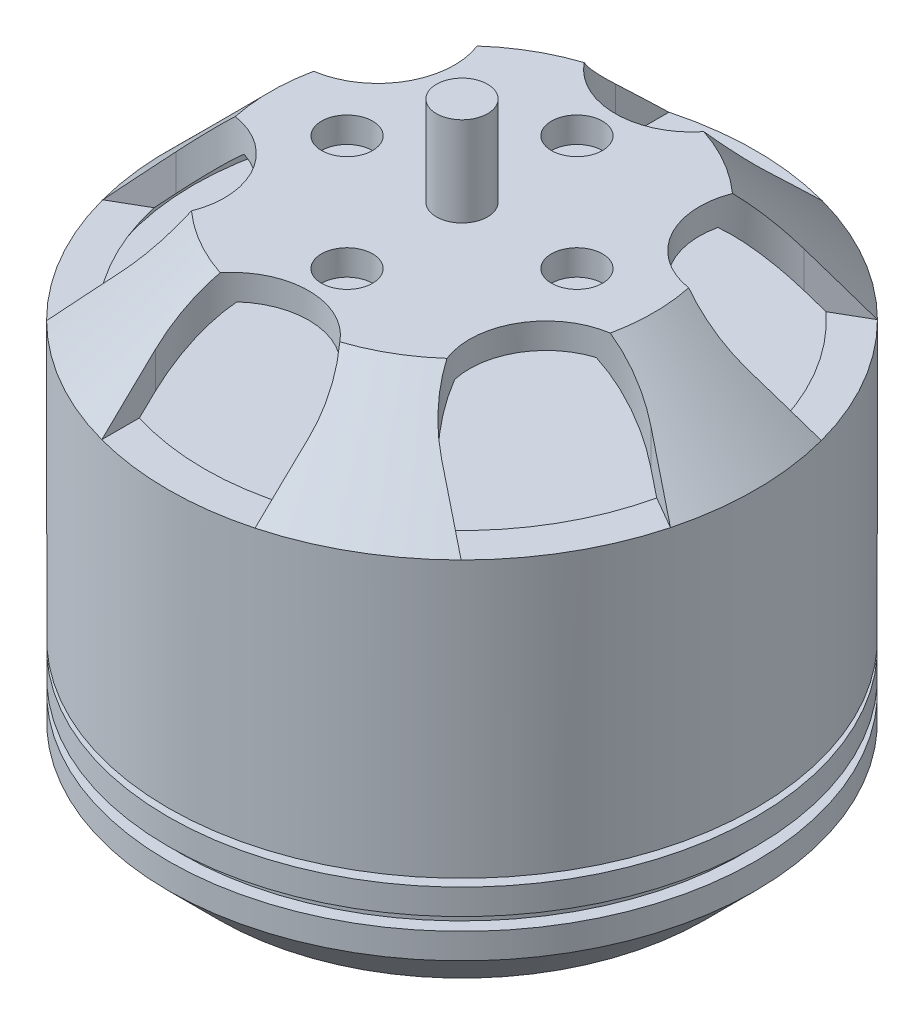
from build123d import *

# Parameters (mm, degrees)
SKETCH3_R          = 1
CUT_EXTRUDE1_DEPTH = 4
SKETCH4_R          = 1
CUT_EXTRUDE2_DEPTH = 3


with BuildPart() as part:
    # Sketch2 → Revolve1 (revolve)
    with BuildSketch(Plane.XY, mode=Mode.PRIVATE) as revolve1_sk:
        Polygon((0, 23.8), (0, 0), (0, -1.090537306), (1, -1.090537306), (1, 0.709462694), (9.5, 0.709462694), (11.5, 2.709462694), (11.5, 3.709462694), (11, 3.709462694), (11, 4.209462694), (11.5, 4.209462694), (11.5, 5.209462694), (9.5, 5.209462694), (9.5, 5.509462694), (11.5, 5.509462694), (11.5, 16.3), (7.5, 20.3), (1, 20.3), (1, 23.8), align=None)
        Polygon((2, 19.3), (7.085786438, 19.3), (10.5, 15.885786438), (10.5, 15.641222404), (1, 15.641222404), (1, 18.3), (2, 18.3), align=None, mode=Mode.SUBTRACT)
    revolve(revolve1_sk.sketch.rotate(Axis((0, 23.8, 0), (0, -1, 0)), 90), axis=Axis((0, 23.8, 0), (0, -1, 0)))

    # Sketch3 → Cut-Extrude1 (cut)
    with BuildSketch(Plane(origin=(0, 20.3, 0), x_dir=(1, 0, 0), z_dir=(0, 1, 0))):
        with Locations(Location((0, -4.5, 0), (0, 0, 270))):
            Circle(SKETCH3_R)
        with Locations(Location((-4.5, 0, 0), (0, 0, 270))):
            Circle(SKETCH3_R)
        with Locations(Location((0, 4.5, 0), (0, 0, 270))):
            Circle(SKETCH3_R)
        with Locations(Location((4.5, 0, 0), (0, 0, 270))):
            Circle(SKETCH3_R)
        with BuildLine():
            Line((-3, 9), (-3, 17.672206418))
            Line((-3, 17.672206418), (3, 17.672206418))
            Line((3, 17.672206418), (3, 9))
            ThreePointArc((3, 9), (0, 6), (-3, 9))
        make_face()
        with BuildLine():
            Line((16.804579699, 6.238026998), (9.294228634, 1.901923789))
            ThreePointArc((9.294228634, 1.901923789), (5.196152423, 3), (6.294228634, 7.098076211))
            Line((6.294228634, 7.098076211), (13.804579699, 11.434179421))
            Line((13.804579699, 11.434179421), (16.804579699, 6.238026998))
        make_face()
        with BuildLine():
            Line((13.804579699, -11.434179421), (6.294228634, -7.098076211))
            ThreePointArc((6.294228634, -7.098076211), (5.196152423, -3), (9.294228634, -1.901923789))
            Line((9.294228634, -1.901923789), (16.804579699, -6.238026998))
            Line((16.804579699, -6.238026998), (13.804579699, -11.434179421))
        make_face()
        with BuildLine():
            Line((-3, -17.672206418), (-3, -9))
            ThreePointArc((-3, -9), (0, -6), (3, -9))
            Line((3, -9), (3, -17.672206418))
            Line((3, -17.672206418), (-3, -17.672206418))
        make_face()
        with BuildLine():
            Line((-16.804579699, -6.238026998), (-9.294228634, -1.901923789))
            ThreePointArc((-9.294228634, -1.901923789), (-5.196152423, -3), (-6.294228634, -7.098076211))
            Line((-6.294228634, -7.098076211), (-13.804579699, -11.434179421))
            Line((-13.804579699, -11.434179421), (-16.804579699, -6.238026998))
        make_face()
        with BuildLine():
            Line((-13.804579699, 11.434179421), (-6.294228634, 7.098076211))
            ThreePointArc((-6.294228634, 7.098076211), (-5.196152423, 3), (-9.294228634, 1.901923789))
            Line((-9.294228634, 1.901923789), (-16.804579699, 6.238026998))
            Line((-16.804579699, 6.238026998), (-13.804579699, 11.434179421))
        make_face()
    extrude(amount=-CUT_EXTRUDE1_DEPTH, mode=Mode.SUBTRACT)

    # Sketch4 → Cut-Extrude2 (cut)
    with BuildSketch(Plane.XZ.offset(-0.709462694)):
        with Locations(Location((0, 6, 0), (0, 0, 270))):
            Circle(SKETCH4_R)
        with Locations(Location((8, 0, 0), (0, 0, 270))):
            Circle(SKETCH4_R)
        with Locations(Location((0, -6, 0), (0, 0, 270))):
            Circle(SKETCH4_R)
        with Locations(Location((-8, 0, 0), (0, 0, 270))):
            Circle(SKETCH4_R)
    extrude(amount=-CUT_EXTRUDE2_DEPTH, mode=Mode.SUBTRACT)


solid = part.part
